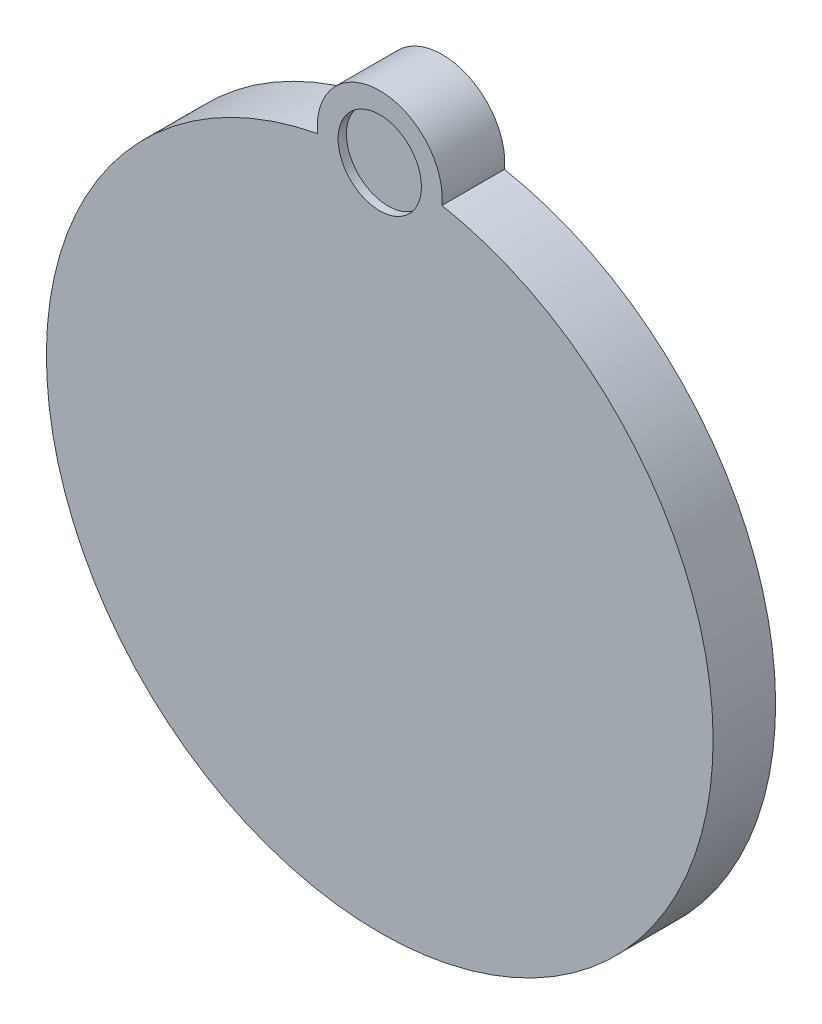
from build123d import *

# Parameters (mm, degrees)
EXTRUDE_1_DEPTH     = 15
SKETCH_10_R         = 10
CUT_EXTRUDE_3_DEPTH = 2


with BuildPart() as part:
    # ｽｹｯﾁ4 → ﾎﾞｽ - 押し出し1 (new body)
    with BuildSketch(Plane.XY):
        with BuildLine():
            ThreePointArc((14.933936552, -1.40625), (0, 15), (-14.933936552, -1.40625))
            ThreePointArc((-14.933936552, -1.40625), (0, -160), (14.933936552, -1.40625))
        make_face()
    extrude(amount=EXTRUDE_1_DEPTH)

    # ｽｹｯﾁ10 → ｶｯﾄ - 押し出し3 (cut)
    with BuildSketch(Plane.XY.offset(15)):
        Circle(SKETCH_10_R)
    extrude(amount=-CUT_EXTRUDE_3_DEPTH, mode=Mode.SUBTRACT)


solid = part.part
